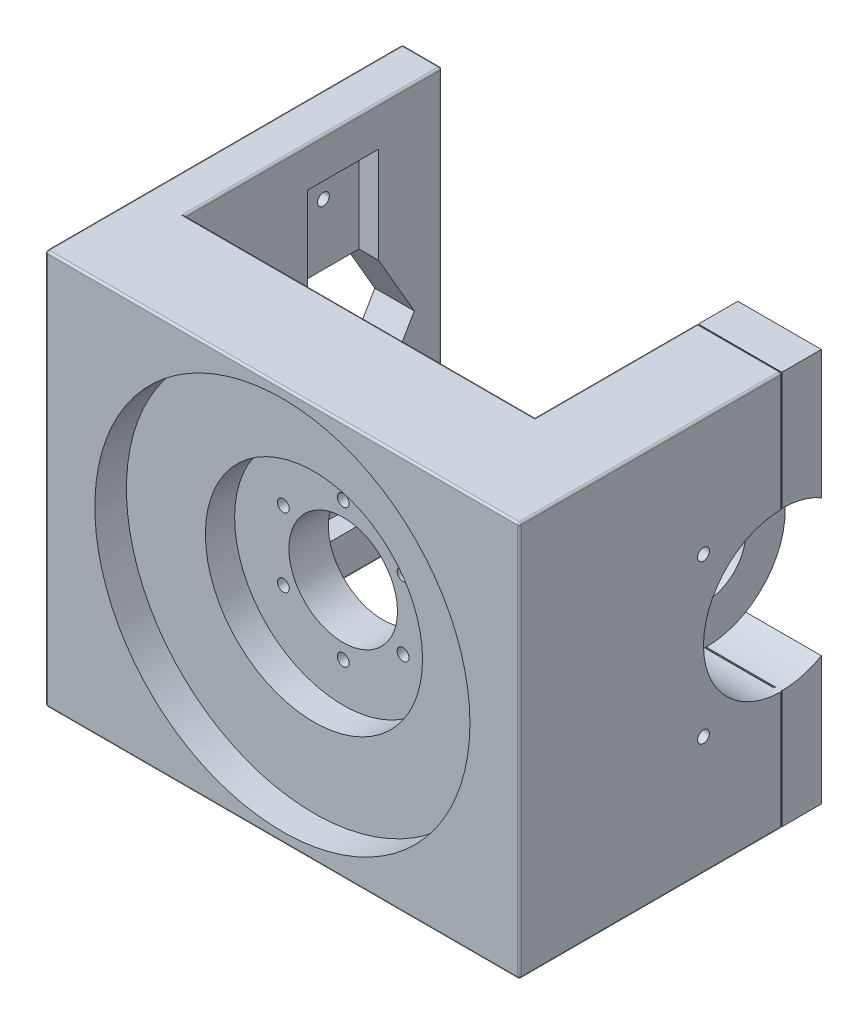
from build123d import *

# Parameters (mm, degrees)
SKETCH_1_R               = 100
SKETCH_1_R_2             = 95
EXTRUDE_1_DEPTH          = 50.8
SKETCH_2_R               = 95
SKETCH_2_R_2             = 55
EXTRUDE_2_DEPTH          = 34.8
SKETCH_4_R               = 55
SKETCH_4_R_2             = 3
SKETCH_4_R_3             = 27.5
EXTRUDE_3_DEPTH          = 20
SKETCH_5_R               = 3
CUT_EXTRUDE_2_DEPTH      = 20
PATTERN_CIRCULAR_3_COUNT = 6
EXTRUDE_4_DEPTH          = 50.8
SKETCH_7_W               = 80
SKETCH_7_H               = 200
EXTRUDE_5_DEPTH          = 100
SKETCH_8_W               = 80
SKETCH_8_H               = 200
CUT_EXTRUDE_3_DEPTH      = 100
CUT_EXTRUDE_5_DEPTH      = 218.118953572
CUT_EXTRUDE_5_DEPTH_BACK = 100
SKETCH_11_W              = 60
SKETCH_11_H              = 200
SKETCH_15_W              = 20
SKETCH_15_H              = 200
EXTRUDE_6_DEPTH          = 30
CUT_EXTRUDE_13_DEPTH     = 20
SKETCH_19_W              = 36
SKETCH_19_H              = 160
CUT_EXTRUDE_14_DEPTH     = 10
SKETCH_20_R              = 3
CUT_EXTRUDE_15_DEPTH     = 10
SKETCH_21_W              = 21.45
SKETCH_21_H              = 200
EXTRUDE_9_DEPTH          = 82.5
SKETCH_26_R              = 40
CUT_EXTRUDE_19_DEPTH     = 17.45
SKETCH_27_R              = 17.5
CUT_EXTRUDE_20_DEPTH     = 17.45
FILLET_1_R               = 1
FILLET_2_R               = 1
SKETCH_31_W              = 42.314213562
SKETCH_31_H              = 199.414213562
EXTRUDE_11_DEPTH         = 20
CUT_EXTRUDE_START        = -50
SKETCH_32_R              = 40
CUT_EXTRUDE_23_DEPTH     = 50
SKETCH_33_R              = 40
EXTRUDE_12_DEPTH         = 4
SKETCH_34_R              = 20
CUT_EXTRUDE_24_DEPTH     = 4
SKETCH_39_R              = 3
CUT_EXTRUDE_26_DEPTH     = 20


with BuildPart() as part:
    # 草图1 → 凸台-拉伸1 (new body)
    with BuildSketch(Plane.XY):
        Circle(SKETCH_1_R)
        Circle(SKETCH_1_R_2, mode=Mode.SUBTRACT)
    extrude(amount=EXTRUDE_1_DEPTH)

    # 草图2 → 凸台-拉伸2 (add)
    with BuildSketch(Plane.XY):
        Circle(SKETCH_2_R)
        Circle(SKETCH_2_R_2, mode=Mode.SUBTRACT)
    extrude(amount=EXTRUDE_2_DEPTH)

    # 草图4 → 凸台-拉伸3 (add)
    with BuildSketch(Plane.XY):
        Circle(SKETCH_4_R)
        with Locations((0, -35)):
            Circle(SKETCH_4_R_2, mode=Mode.SUBTRACT)
        Circle(SKETCH_4_R_3, mode=Mode.SUBTRACT)
    extrude(amount=EXTRUDE_3_DEPTH)

    # 草图5 → 切除-拉伸2 (cut)
    with BuildSketch(Plane(origin=(0, 0, 0), x_dir=(-1, 0, 0), z_dir=(0, 0, -1))):
        with Locations((0, 35)):
            Circle(SKETCH_5_R)
    cut_extrude_2 = extrude(amount=-CUT_EXTRUDE_2_DEPTH, mode=Mode.SUBTRACT)

    # 阵列(圆周)3: 切除-拉伸2 ×6 about axis
    pattern_circular_3_axis = Axis((0, 0, 0), (0, 0, 1))
    for i in range(1, PATTERN_CIRCULAR_3_COUNT):
        add(cut_extrude_2.rotate(pattern_circular_3_axis, i * 360 / PATTERN_CIRCULAR_3_COUNT), mode=Mode.SUBTRACT)

    # 草图6 → 凸台-拉伸4 (add)
    with BuildSketch(Plane(origin=(0, 0, 0), x_dir=(-1, 0, 0), z_dir=(0, 0, -1))):
        with BuildLine():
            ThreePointArc((100, 0), (70.71067814, -70.710678097), (6.1e-08, -100))
            Line((6.1e-08, -100), (200, -100))
            Line((200, -100), (200, 100))
            Line((200, 100), (0, 100))
            ThreePointArc((0, 100), (70.710678119, 70.710678119), (100, 0))
        make_face()
        with BuildLine():
            Line((-200, 100), (-200, -100))
            Line((-200, -100), (6.1e-08, -100))
            ThreePointArc((6.1e-08, -100), (-100, -3e-08), (0, 100))
            Line((0, 100), (-200, 100))
        make_face()
    extrude(amount=-EXTRUDE_4_DEPTH)

    # 草图7 → 凸台-拉伸5 (add)
    with BuildSketch(Plane(origin=(0, 0, 0), x_dir=(-1, 0, 0), z_dir=(0, 0, -1))):
        with Locations((80, 0)):
            Rectangle(SKETCH_7_W, SKETCH_7_H)
    extrude(amount=EXTRUDE_5_DEPTH)

    # 草图8 → 切除-拉伸3 (cut)
    with BuildSketch(Plane(origin=(0, 0, 0), x_dir=(-1, 0, 0), z_dir=(0, 0, -1))):
        with Locations((160, 0)):
            Rectangle(SKETCH_8_W, SKETCH_8_H)
    cut_extrude_3 = extrude(amount=-CUT_EXTRUDE_3_DEPTH, mode=Mode.SUBTRACT)

    # 镜向2: 切除-拉伸3 across plane
    add(cut_extrude_3.mirror(Plane(origin=(0, 0, 0), x_dir=(0, 0, 1), z_dir=(1, 0, 0))), mode=Mode.SUBTRACT)

    # 草图11 → 切除-拉伸5 (cut, two sides: drawn at the far end of the back side and taken through both)
    with BuildSketch(Plane(origin=(0, 0, -100), x_dir=(-1, 0, 0), z_dir=(0, 0, -1)).offset(-CUT_EXTRUDE_5_DEPTH_BACK)):
        with Locations((70, 0)):
            Rectangle(SKETCH_11_W, SKETCH_11_H)
    extrude(amount=CUT_EXTRUDE_5_DEPTH + CUT_EXTRUDE_5_DEPTH_BACK, mode=Mode.SUBTRACT)

    # 草图15 → 凸台-拉伸6 (add)
    with BuildSketch(Plane(origin=(0, 0, -100), x_dir=(-1, 0, 0), z_dir=(0, 0, -1))):
        with Locations((110, 0)):
            Rectangle(SKETCH_15_W, SKETCH_15_H)
    extrude(amount=EXTRUDE_6_DEPTH)

    # 草图16 → 切除-拉伸13 (cut)
    with BuildSketch(Plane(origin=(-100, 0, 0), x_dir=(0, 0, -1), z_dir=(1, 0, 0))):
        Polygon((80, 0), (44, 0), (62, -31.176914536), (80, -31.176914536), align=None)
        Polygon((62, 31.176914536), (44, 0), (80, 0), (80, 31.176914536), align=None)
        Polygon((80, 31.176914536), (80, 0), (116, 0), (98, 31.176914536), align=None)
        Polygon((116, 0), (80, 0), (80, -31.176914536), (98, -31.176914536), align=None)
    extrude(amount=-CUT_EXTRUDE_13_DEPTH, mode=Mode.SUBTRACT)

    # 草图19 → 切除-拉伸14 (cut)
    with BuildSketch(Plane(origin=(-100, 0, 0), x_dir=(0, 0, -1), z_dir=(1, 0, 0))):
        with Locations((80, 0)):
            Rectangle(SKETCH_19_W, SKETCH_19_H)
    extrude(amount=-CUT_EXTRUDE_14_DEPTH, mode=Mode.SUBTRACT)

    # 草图20 → 切除-拉伸15 (cut)
    with BuildSketch(Plane(origin=(-110, 0, 0), x_dir=(0, 0, -1), z_dir=(1, 0, 0))):
        with Locations(Location((80, 62, 0), (0, 0, 90))):
            Circle(SKETCH_20_R)
    cut_extrude_15 = extrude(amount=-CUT_EXTRUDE_15_DEPTH, mode=Mode.SUBTRACT)

    # 镜向6: 切除-拉伸15 across plane
    add(cut_extrude_15.mirror(Plane.ZX), mode=Mode.SUBTRACT)

    # 草图21 → 凸台-拉伸9 (add)
    with BuildSketch(Plane(origin=(0, 0, 0), x_dir=(-1, 0, 0), z_dir=(0, 0, -1))):
        with Locations((-109.275, 0)):
            Rectangle(SKETCH_21_W, SKETCH_21_H)
    extrude_9 = extrude(amount=EXTRUDE_9_DEPTH)

    # 草图26 → 切除-拉伸19 (cut)
    with BuildSketch(Plane.ZY.offset(-98.55)):
        with Locations((-82.5, 0)):
            Circle(SKETCH_26_R)
    cut_extrude_19 = extrude(amount=-CUT_EXTRUDE_19_DEPTH, mode=Mode.SUBTRACT)

    # 草图27 → 切除-拉伸20 (cut)
    with BuildSketch(Plane.ZY.offset(-116)):
        with Locations((-82.5, 0)):
            Circle(SKETCH_27_R)
    cut_extrude_20 = extrude(amount=-CUT_EXTRUDE_20_DEPTH, mode=Mode.SUBTRACT)

    # 镜向8: 凸台-拉伸9, 切除-拉伸19, 切除-拉伸20 across plane
    add(extrude_9.mirror(Plane(origin=(98.55, 0, 0), x_dir=(0, 0, 1), z_dir=(1, 0, 0))))
    add(cut_extrude_19.mirror(Plane(origin=(98.55, 0, 0), x_dir=(0, 0, 1), z_dir=(1, 0, 0))), mode=Mode.SUBTRACT)
    add(cut_extrude_20.mirror(Plane(origin=(98.55, 0, 0), x_dir=(0, 0, 1), z_dir=(1, 0, 0))), mode=Mode.SUBTRACT)

    # 圆角1
    fillet_1_edges = [part.edges().sort_by_distance(p)[0] for p in [
        (120, 100, -15.85),
        (120, -100, -15.85),
        (98.55, -100, -82.5),
        (98.55, 100, -82.5),
        (120, 58.75, -82.5),
        (116, -28.75, -82.5),
        (98.55, 40, -82.5),
        (98.55, -40, -82.5),
        (116, 28.75, -82.5),
        (116, 0, -65),
        (120, -58.75, -82.5),
        (120, 0, -65),
        (118, -17.5, -82.5),
        (118, 17.5, -82.5),
        (77.1, 58.75, -82.5),
        (77.1, -100, -41.25),
        (77.1, 100, -41.25),
        (81.1, 28.75, -82.5),
        (81.1, 0, -42.5),
        (81.1, -28.75, -82.5),
        (81.1, 0, -65),
        (77.1, -58.75, -82.5),
        (79.1, 17.5, -82.5),
        (77.1, 0, -65),
        (79.1, -17.5, -82.5),
    ]]
    fillet(fillet_1_edges, radius=FILLET_1_R)

    # 圆角2
    fillet_2_edges = [part.edges().sort_by_distance(p)[0] for p in [
        (119.707106781, -99.707106781, 50.8),
        (119.707106781, 99.707106781, 50.8),
        (-120, 0, 50.8),
        (-0.5, -100, 50.8),
        (-0.5, 100, 50.8),
        (120, 0, 50.8),
        (-10.95, -100, 0),
        (-10.95, 100, 0),
        (-100, -100, -65),
        (-120, -100, -39.6),
        (-110, -100, -130),
        (-100, 100, -65),
        (-100, 0, -130),
        (-110, 100, -130),
        (-120, 0, -130),
        (-120, 100, -39.6),
    ]]
    fillet(fillet_2_edges, radius=FILLET_2_R)

    # 草图31 → 凸台-拉伸11 (add)
    with BuildSketch(Plane(origin=(0, 0, -82.5), x_dir=(-1, 0, 0), z_dir=(0, 0, -1))):
        with Locations((-98.55, 0)):
            Rectangle(SKETCH_31_W, SKETCH_31_H)
    extrude(amount=EXTRUDE_11_DEPTH)

    # 草图32 → 切除-拉伸23 (cut)
    with BuildSketch(Plane(origin=(120, 0, 0), x_dir=(0, 0, -1), z_dir=(1, 0, 0)).offset(CUT_EXTRUDE_START)):
        with Locations((82.5, 0)):
            Circle(SKETCH_32_R)
    extrude(amount=CUT_EXTRUDE_23_DEPTH, mode=Mode.SUBTRACT)

    # 草图33 → 凸台-拉伸12 (add)
    with BuildSketch(Plane.ZY.offset(-77.392893219)):
        with Locations((-82.5, 0)):
            Circle(SKETCH_33_R)
    extrude(amount=-EXTRUDE_12_DEPTH)

    # 草图34 → 切除-拉伸24 (cut)
    with BuildSketch(Plane.ZY.offset(-77.392893219)):
        with Locations((-82.5, 0)):
            Circle(SKETCH_34_R)
    extrude(amount=-CUT_EXTRUDE_24_DEPTH, mode=Mode.SUBTRACT)

    # 草图39 → 切除-拉伸26 (cut)
    with BuildSketch(Plane(origin=(120, 0, 0), x_dir=(0, 0, -1), z_dir=(1, 0, 0))):
        with Locations(Location((42.5, 40, 0), (0, 0, 90))):
            Circle(SKETCH_39_R)
        with Locations(Location((42.5, -40, 0), (0, 0, 90))):
            Circle(SKETCH_39_R)
    extrude(amount=-CUT_EXTRUDE_26_DEPTH, mode=Mode.SUBTRACT)


solid = part.part
